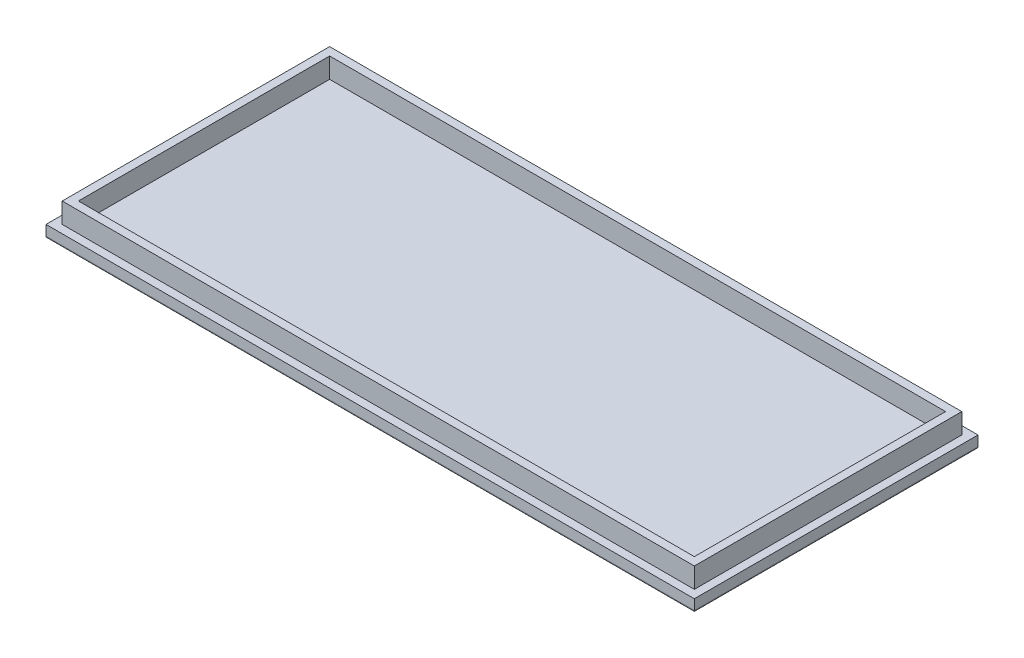
from build123d import *

# Parameters (mm, degrees)
SKETCH_1_W           = 160
SKETCH_1_H           = 70
SKETCH_1_W_2         = 156
SKETCH_1_H_2         = 66
EXTRUDE_1_DEPTH      = 3
EXTRUDE_2_DEPTH      = 5
EXTRUDE_2_DEPTH_BACK = 3
SKETCH_2_W           = 156
SKETCH_2_H           = 66
SKETCH_3_W           = 152
SKETCH_3_H           = 62
CUT_EXTRUDE_1_DEPTH  = 5
FILLET_1_R           = 0.5


with BuildPart() as part:
    # 스케치1 → 보스-돌출1 (new body)
    with BuildSketch(Plane(origin=(0, 0, 0), x_dir=(1, 0, 0), z_dir=(0, 1, 0))):
        Rectangle(SKETCH_1_W, SKETCH_1_H)
        Rectangle(SKETCH_1_W_2, SKETCH_1_H_2, mode=Mode.SUBTRACT)
    extrude(amount=EXTRUDE_1_DEPTH)

    # 스케치2 → 보스-돌출2 (add, two sides: drawn at the far end of the back side and taken through both)
    with BuildSketch(Plane(origin=(0, 3, 0), x_dir=(1, 0, 0), z_dir=(0, 1, 0)).offset(-EXTRUDE_2_DEPTH_BACK)):
        Rectangle(SKETCH_2_W, SKETCH_2_H)
    extrude(amount=EXTRUDE_2_DEPTH + EXTRUDE_2_DEPTH_BACK)

    # 스케치3 → 컷-돌출1 (cut)
    with BuildSketch(Plane(origin=(0, 8, 0), x_dir=(1, 0, 0), z_dir=(0, 1, 0))):
        Rectangle(SKETCH_3_W, SKETCH_3_H)
    extrude(amount=-CUT_EXTRUDE_1_DEPTH, mode=Mode.SUBTRACT)

    # 필렛1
    fillet_1_edges = [part.edges().sort_by_distance(p)[0] for p in [
        (0, 0, -35),
        (80, 0, 0),
        (0, 0, 35),
        (-80, 0, 0),
    ]]
    fillet(fillet_1_edges, radius=FILLET_1_R)


solid = part.part
